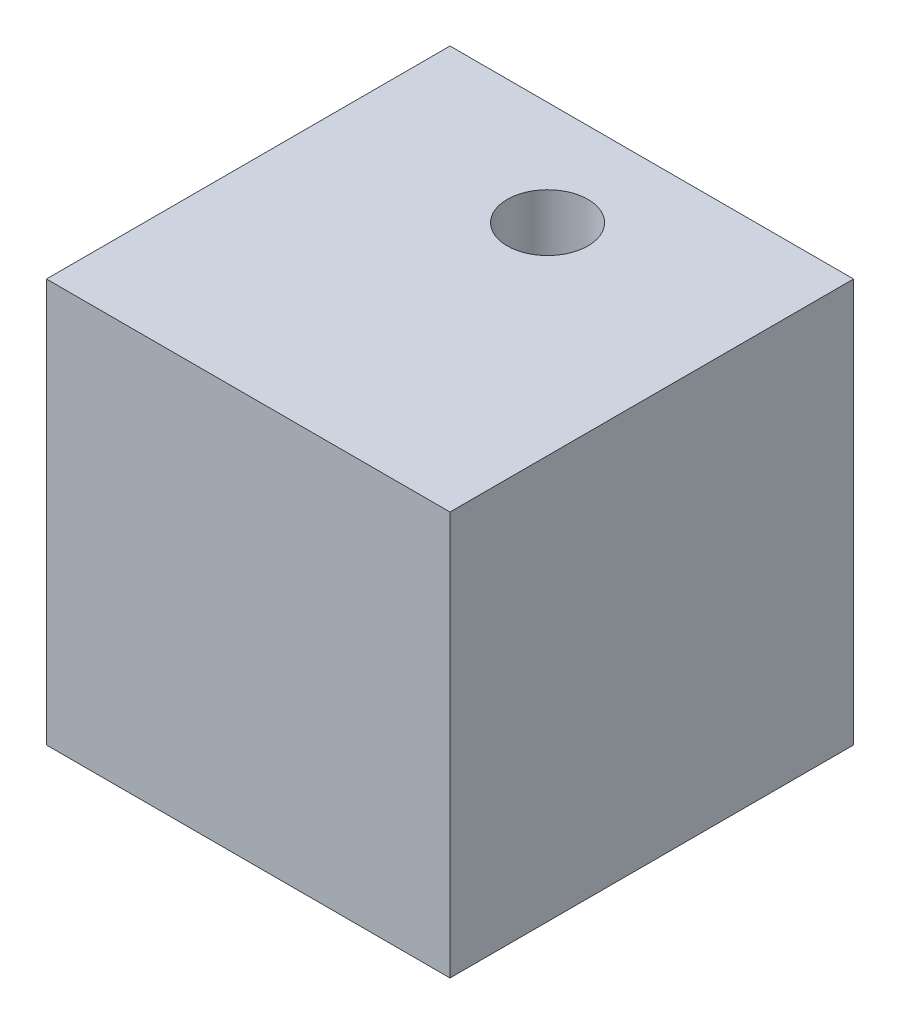
from build123d import *

# Parameters (mm, degrees)
SKETCH_1_W          = 30
SKETCH_1_H          = 30
EXTRUDE_1_DEPTH     = 30
SKETCH_2_R          = 3
CUT_EXTRUDE_1_DEPTH = 10


with BuildPart() as part:
    # 草图1 → 凸台-拉伸1 (new body)
    with BuildSketch(Plane(origin=(0, 0, 0), x_dir=(1, 0, 0), z_dir=(0, 1, 0))):
        Rectangle(SKETCH_1_W, SKETCH_1_H)
    extrude(amount=EXTRUDE_1_DEPTH)

    # 草图2 → 切除-拉伸1 (cut)
    with BuildSketch(Plane(origin=(0, 30, 0), x_dir=(1, 0, 0), z_dir=(0, 1, 0))):
        with Locations(Location((0, 7.254546962, 0), (0, 0, 270))):
            Circle(SKETCH_2_R)
    extrude(amount=-CUT_EXTRUDE_1_DEPTH, mode=Mode.SUBTRACT)


solid = part.part
